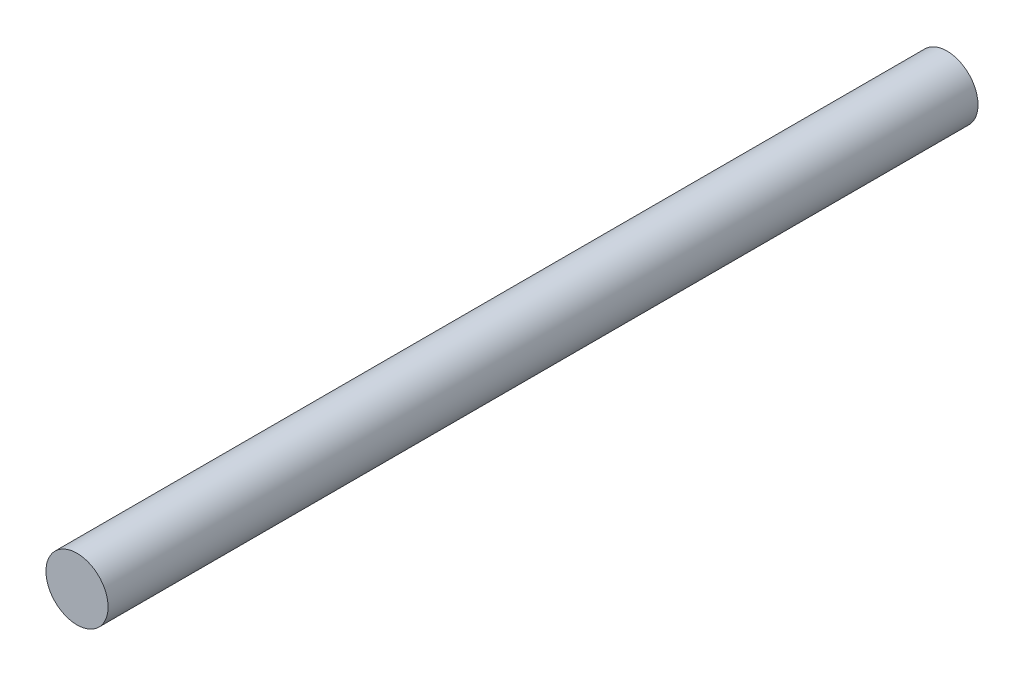
from build123d import *

# Parameters (mm, degrees)
ESQUISSE1_R        = 2.5
BOSS_EXTRU_1_DEPTH = 70


with BuildPart() as part:
    # Esquisse1 → Boss.-Extru.1 (new body)
    with BuildSketch(Plane.XY):
        Circle(ESQUISSE1_R)
    extrude(amount=-BOSS_EXTRU_1_DEPTH)


solid = part.part
